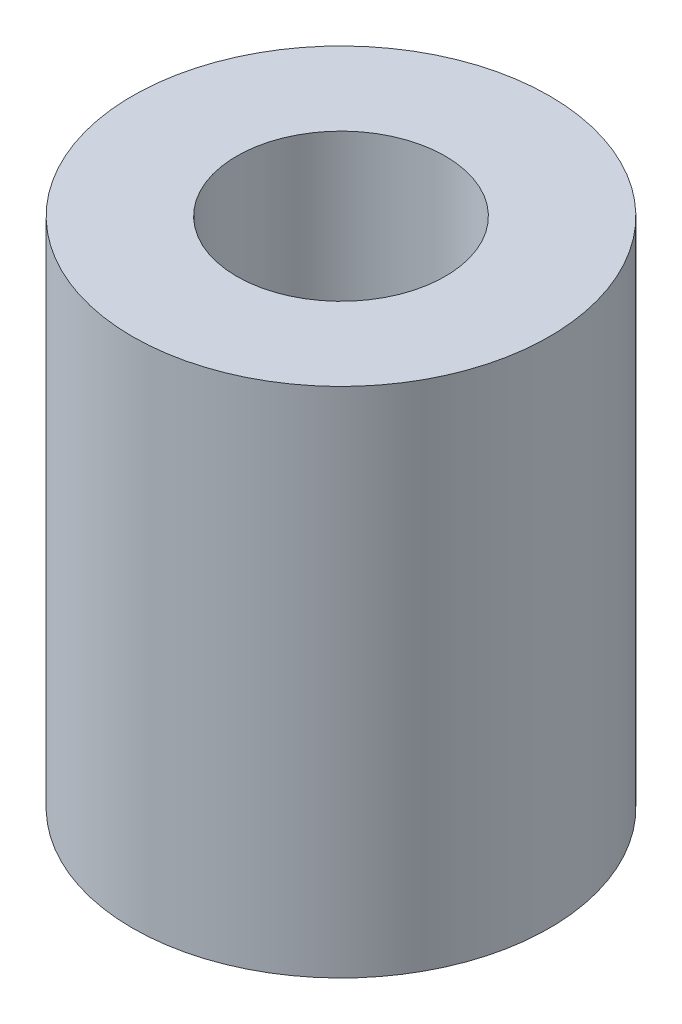
from build123d import *

# Parameters (mm, degrees)
SKETCH1_R           = 14
SKETCH1_R_2         = 7
BOSS_EXTRUDE1_DEPTH = 34.4


with BuildPart() as part:
    # Sketch1 → Boss-Extrude1 (new body)
    with BuildSketch(Plane(origin=(0, 0, 0), x_dir=(1, 0, 0), z_dir=(0, 1, 0))):
        with Locations(Location((0, 0, 0), (0, 0, 90))):
            Circle(SKETCH1_R)
        with Locations(Location((0, 0, 0), (0, 0, 90))):
            Circle(SKETCH1_R_2, mode=Mode.SUBTRACT)
    extrude(amount=BOSS_EXTRUDE1_DEPTH)


solid = part.part
